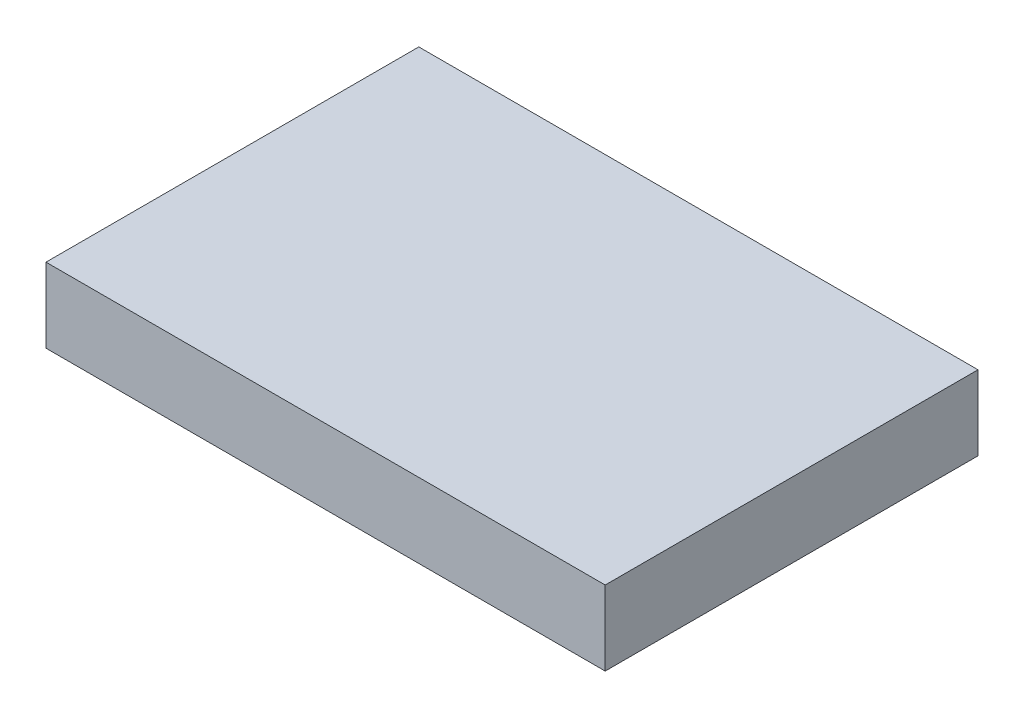
from build123d import *

# Parameters (mm, degrees)
SKETCH2_W           = 75
SKETCH2_H           = 50
PLATE_TOPVIEW_DEPTH = 10


with BuildPart() as part:
    # Sketch2 → Plate_topview (new body)
    with BuildSketch(Plane(origin=(0, 0, 0), x_dir=(1, 0, 0), z_dir=(0, 1, 0))):
        Rectangle(SKETCH2_W, SKETCH2_H)
    extrude(amount=PLATE_TOPVIEW_DEPTH)


solid = part.part
